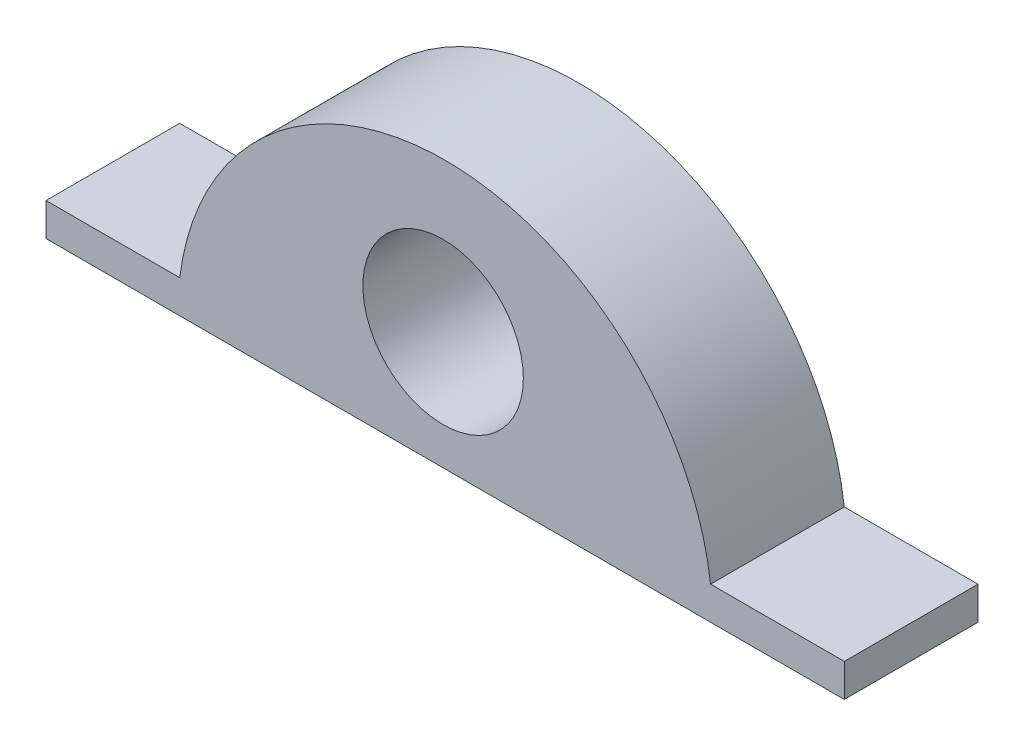
from build123d import *

# Parameters (mm, degrees)
SKETCH1_R           = 15
BOSS_EXTRUDE1_DEPTH = 25


with BuildPart() as part:
    # Sketch1 → Boss-Extrude1 (new body)
    with BuildSketch(Plane.XY):
        with BuildLine():
            Line((-49.61631615, -44.294605809), (49.620610998, -44.294605809))
            Line((49.620610998, -44.294605809), (74.620610998, -44.294605809))
            Line((74.620610998, -44.294605809), (74.620610998, -38.129537072))
            Line((74.620610998, -38.129537072), (49.620610998, -38.129537072))
            ThreePointArc((49.620610998, -38.129537072), (0.002147424, 5.705394191), (-49.61631615, -38.129537072))
            Line((-49.61631615, -38.129537072), (-74.61631615, -38.129537072))
            Line((-74.61631615, -38.129537072), (-74.61631615, -44.294605809))
            Line((-74.61631615, -44.294605809), (-49.61631615, -44.294605809))
        make_face()
        with Locations((-0.379389002, -22.294605809)):
            Circle(SKETCH1_R, mode=Mode.SUBTRACT)
    extrude(amount=BOSS_EXTRUDE1_DEPTH)


solid = part.part
